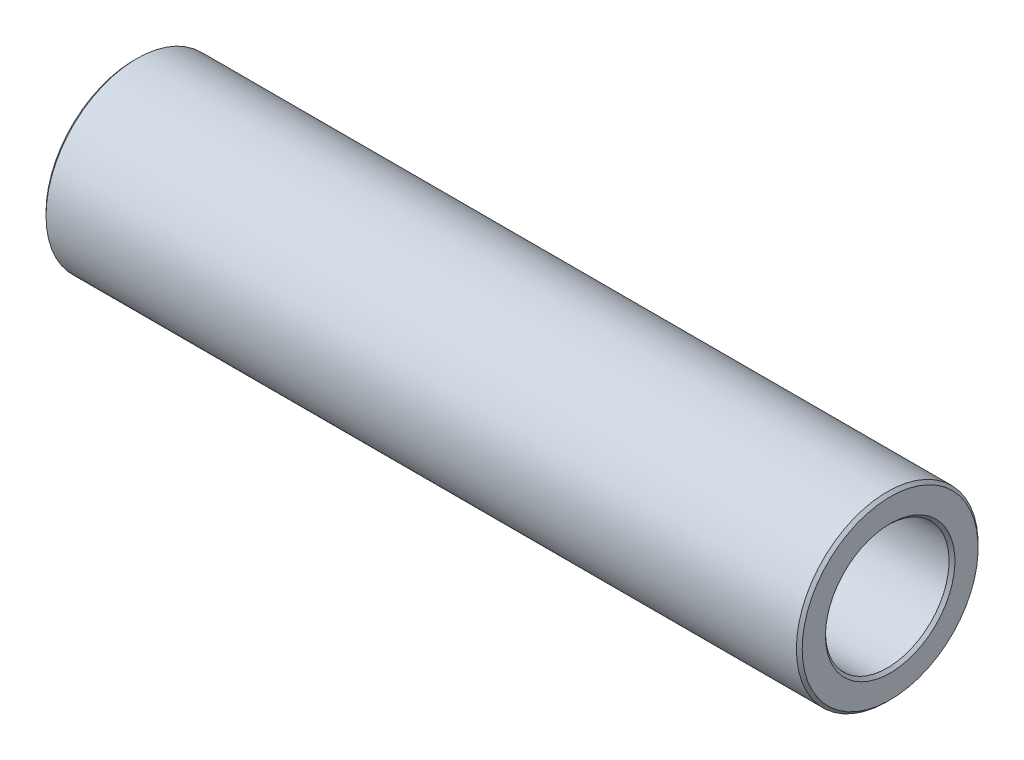
from build123d import *

# Parameters (mm, degrees)
SKETCH_1_W = 52
SKETCH_1_H = 6.25
SKETCH_4_W = 52
SKETCH_4_H = 4.25


with BuildPart() as part:
    # ｽｹｯﾁ1 → 回転1 (revolve)
    with BuildSketch(Plane.XY, mode=Mode.PRIVATE) as revolve_1_sk:
        with Locations((26, 3.125)):
            Rectangle(SKETCH_1_W, SKETCH_1_H)
    revolve(revolve_1_sk.sketch.rotate(Axis((500, 0, 0), (-1, 0, 0)), 270), axis=Axis((500, 0, 0), (-1, 0, 0)))

    # ｽｹｯﾁ2 → ｶｯﾄ - 回転1 (revolve, cut)
    with BuildSketch(Plane.XY, mode=Mode.PRIVATE) as cut_revolve_1_sk:
        Polygon((51.8, 6.25), (52, 6.05), (52, 6.25), align=None)
    revolve(cut_revolve_1_sk.sketch.rotate(Axis((104, 0, 0), (-1, 0, 0)), 270), axis=Axis((104, 0, 0), (-1, 0, 0)), mode=Mode.SUBTRACT)

    # ｽｹｯﾁ3 → ｶｯﾄ - 回転2 (revolve, cut)
    with BuildSketch(Plane.XY, mode=Mode.PRIVATE) as cut_revolve_2_sk:
        Polygon((0, 6.25), (0, 6.05), (0.2, 6.25), align=None)
    revolve(cut_revolve_2_sk.sketch.rotate(Axis((104, 0, 0), (-1, 0, 0)), 270), axis=Axis((104, 0, 0), (-1, 0, 0)), mode=Mode.SUBTRACT)

    # ｽｹｯﾁ4 → ｶｯﾄ - 回転3 (revolve, cut)
    with BuildSketch(Plane.XY, mode=Mode.PRIVATE) as cut_revolve_3_sk:
        with Locations((26, 2.125)):
            Rectangle(SKETCH_4_W, SKETCH_4_H)
    revolve(cut_revolve_3_sk.sketch.rotate(Axis((25, 0, 0), (-1, 0, 0)), 270), axis=Axis((25, 0, 0), (-1, 0, 0)), mode=Mode.SUBTRACT)

    # ｽｹｯﾁ5 → ｶｯﾄ - 回転4 (revolve, cut)
    with BuildSketch(Plane.XY, mode=Mode.PRIVATE) as cut_revolve_4_sk:
        Polygon((0, 4.45), (0, 4.25), (0.2, 4.25), align=None)
    revolve(cut_revolve_4_sk.sketch.rotate(Axis((25, 0, 0), (-1, 0, 0)), 270), axis=Axis((25, 0, 0), (-1, 0, 0)), mode=Mode.SUBTRACT)

    # ｽｹｯﾁ6 → ｶｯﾄ - 回転5 (revolve, cut)
    with BuildSketch(Plane.XY, mode=Mode.PRIVATE) as cut_revolve_5_sk:
        Polygon((51.8, 4.25), (52, 4.25), (52, 4.45), align=None)
    revolve(cut_revolve_5_sk.sketch.rotate(Axis((25, 0, 0), (-1, 0, 0)), 270), axis=Axis((25, 0, 0), (-1, 0, 0)), mode=Mode.SUBTRACT)


solid = part.part
